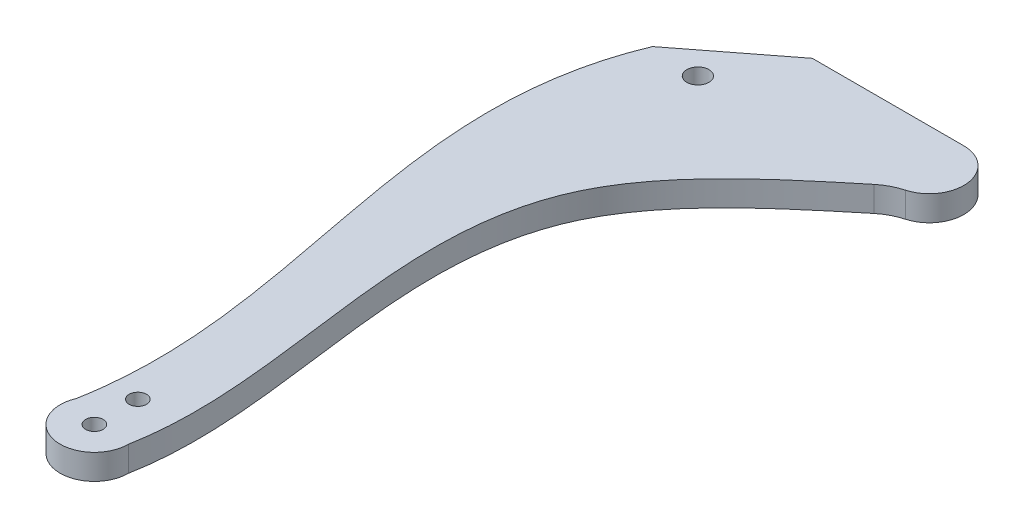
from build123d import *

# Parameters (mm, degrees)
SKETCH1_R           = 1.975
SKETCH1_R_2         = 1.554999938
BOSS_EXTRUDE1_DEPTH = 4.5


with BuildPart() as part:
    # Sketch1 → Boss-Extrude1 (new body)
    with BuildSketch(Plane(origin=(0, 0, 0), x_dir=(1, 0, 0), z_dir=(0, 1, 0))):
        with BuildLine():
            Line((-16.144899663, 8.454003274), (10.877745108, 8.454003274))
            ThreePointArc((10.877745108, 8.454003274), (16.961539544, 3.139522495), (12.51277209, -3.603231306))
            ThreePointArc((12.51277209, -3.603231306), (10.56783567, -4.367093581), (8.824099884, -5.518461795))
            add(Edge.make_bspline(
                [(8.824099884, -5.518461795), (4.932532744, -8.718832913), (-4.696045283, -16.58586855), (-31.489086781, -46.943790059), (-12.894682963, -87.326546642), (-17.517744483, -112.138995974)],
                knots=[0.023478108, 0.023478108, 0.023478108, 0.023478108, 0.154944007, 0.330832674, 1, 1, 1, 1], degree=3))
            ThreePointArc((-17.517744483, -112.138995974), (-24.835663445, -118.119615453), (-29.239494185, -109.757437382))
            add(Edge.make_bspline(
                [(-32.217521916, -3.987452131), (-42.206514906, -27.827820505), (-29.561370115, -63.982250345), (-27.390169054, -99.665041987), (-29.239494185, -109.757437382)],
                knots=[0, 0, 0, 0, 0.696305279, 0.977824201, 0.977824201, 0.977824201, 0.977824201], degree=3))
            Line((-32.217521916, -3.987452131), (-16.144899663, 8.454003274))
        make_face()
        with Locations(Location((-23.620555115, -4.478995902, 0), (0, 0, 270))):
            Circle(SKETCH1_R, mode=Mode.SUBTRACT)
        with Locations(Location((-23.620555115, -112.138995974, 0), (0, 0, 270))):
            Circle(SKETCH1_R_2, mode=Mode.SUBTRACT)
        with Locations(Location((-23.620555115, -104.378996, 0), (0, 0, 270))):
            Circle(SKETCH1_R_2, mode=Mode.SUBTRACT)
    extrude(amount=BOSS_EXTRUDE1_DEPTH)


solid = part.part
